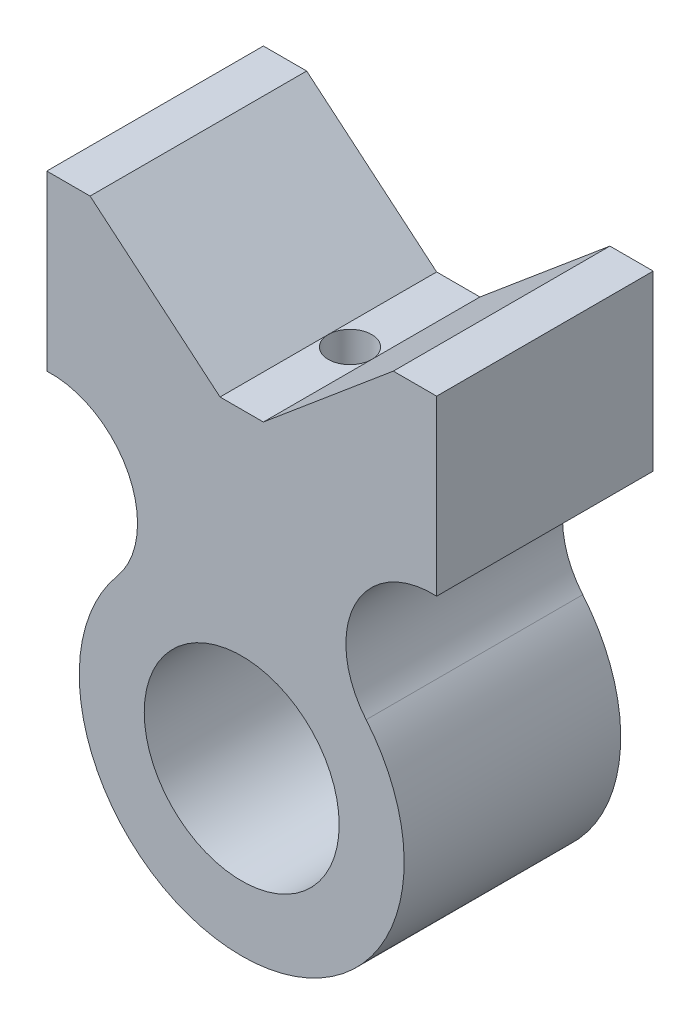
from build123d import *

# Parameters (mm, degrees)
SKETCH1_R               = 22.5
BOSS_EXTRUDE1_DEPTH     = 50
CUT_EXTRUDE1_REACH      = 130.311
CUT_EXTRUDE1_END_RADIUS = 22.5
SKETCH2_R               = 5


with BuildPart() as part:
    # Sketch1 → Boss-Extrude1 (new body)
    with BuildSketch(Plane.XY):
        with BuildLine():
            Line((45, 56.93759592), (45, 96.93759592))
            Line((45, 96.93759592), (35, 96.93759592))
            Line((35, 96.93759592), (5, 71.764606985))
            Line((5, 71.764606985), (-5, 71.764606985))
            Line((-5, 71.764606985), (-35, 96.93759592))
            Line((-35, 96.93759592), (-45, 96.93759592))
            Line((-45, 96.93759592), (-45, 56.93759592))
            ThreePointArc((-45, 56.93759592), (-26.127859204, 45.841981394), (-28.726666617, 24.104535363))
            ThreePointArc((-28.726666617, 24.104535363), (0, -37.5), (28.726666617, 24.104535363))
            ThreePointArc((28.726666617, 24.104535363), (26.127859204, 45.841981394), (45, 56.93759592))
        make_face()
        Circle(SKETCH1_R, mode=Mode.SUBTRACT)
    extrude(amount=BOSS_EXTRUDE1_DEPTH)

    # Cut-Extrude1: up to this cylinder (the profile starts outside it)
    cut_extrude1_end = Plane(origin=(0, 0, 25), z_dir=(0, 0, -1)) * Cylinder(CUT_EXTRUDE1_END_RADIUS, 306.622, mode=Mode.PRIVATE)
    # Sketch2 → Cut-Extrude1 (cut, up to the surface)
    with BuildSketch(Plane(origin=(0, 71.764606985, 0), x_dir=(1, 0, 0), z_dir=(0, 1, 0)), mode=Mode.PRIVATE) as cut_extrude1_sk1:
        with Locations(Location((0, -25, 0), (0, 0, 180))):
            Circle(SKETCH2_R)
    cut_extrude1_tool1 = extrude(cut_extrude1_sk1.sketch, amount=-CUT_EXTRUDE1_REACH, mode=Mode.PRIVATE) - cut_extrude1_end
    add(cut_extrude1_tool1.solids().sort_by_distance((0, 71.764607, 25))[0], mode=Mode.SUBTRACT)


solid = part.part
